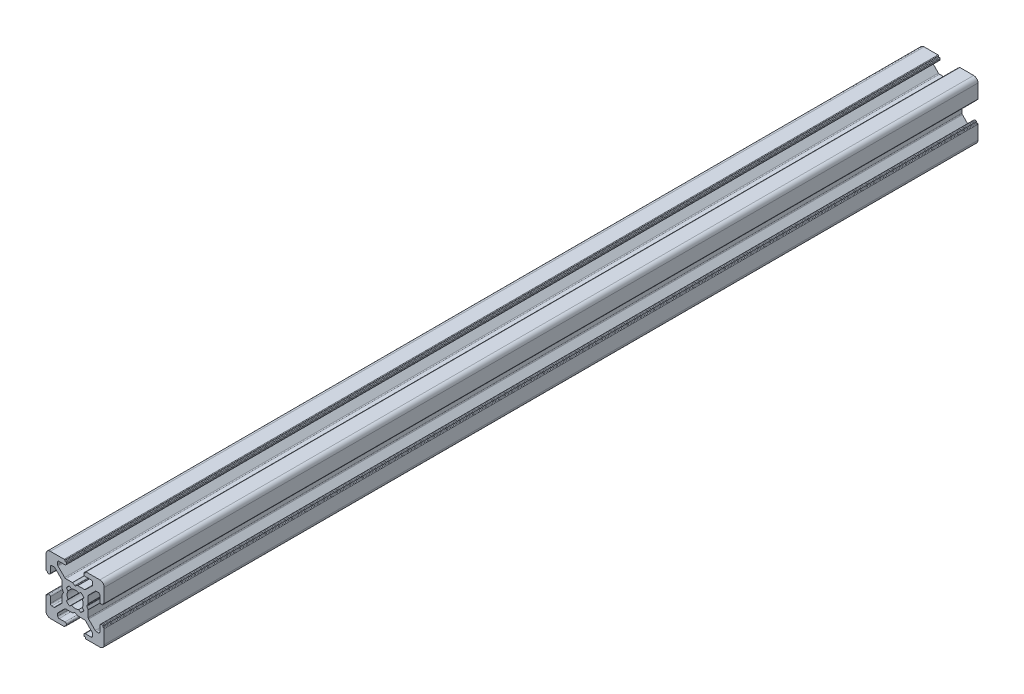
from build123d import *

# Parameters (mm, degrees)
BOSS_EXTRUDE1_DEPTH = 300


with BuildPart() as part:
    # Sketch3 → Boss-Extrude1 (new body)
    with BuildSketch(Plane.XY):
        with BuildLine():
            Line((-3.750000228, 10), (-8.5, 10))
            ThreePointArc((-8.5, 10), (-9.560660172, 9.560660172), (-10, 8.5))
            Line((-10, 8.5), (-10, 3.749999605))
            ThreePointArc((-10, 3.749999605), (-9.941421356, 3.608578248), (-9.8, 3.549999605))
            Line((-9.8, 3.549999605), (-9.699999732, 3.549999605))
            ThreePointArc((-9.699999732, 3.549999605), (-9.558578376, 3.491420961), (-9.499999732, 3.349999605))
            Line((-9.499999732, 3.349999605), (-9.499999732, 3.2))
            ThreePointArc((-9.499999732, 3.2), (-9.441421088, 3.058578644), (-9.299999732, 3))
            Line((-9.299999732, 3), (-8.999999732, 3))
            ThreePointArc((-8.999999732, 3), (-8.646446341, 3.146446609), (-8.499999732, 3.5))
            Line((-8.499999732, 3.5), (-8.499999732, 5.499999605))
            ThreePointArc((-8.499999732, 5.499999605), (-8.353553123, 5.853552995), (-7.999999732, 5.999999605))
            Line((-7.999999732, 5.999999605), (-7.267766685, 5.999999605))
            ThreePointArc((-7.267766685, 5.999999605), (-7.076424969, 5.961939371), (-6.914213294, 5.853552995))
            Line((-6.914213294, 5.853552995), (-4.646446398, 3.585786099))
            ThreePointArc((-4.646446398, 3.585786099), (-4.538060023, 3.423574425), (-4.499999789, 3.232232708))
            Line((-4.499999789, 3.232232708), (-4.499999789, 0.953589302))
            ThreePointArc((-4.499999789, 0.953589302), (-4.493184953, 0.90182549), (-4.473204867, 0.853589297))
            Line((-4.473204867, 0.853589297), (-4.038119841, 0.099999969))
            ThreePointArc((-4.038119841, 0.099999969), (-4.011324929, 0), (-4.038119841, -0.099999969))
            Line((-4.038119841, -0.099999969), (-4.473204867, -0.853589297))
            ThreePointArc((-4.473204867, -0.853589297), (-4.493184953, -0.90182549), (-4.499999789, -0.953589302))
            Line((-4.499999789, -0.953589302), (-4.499999789, -3.232232708))
            ThreePointArc((-4.499999789, -3.232232708), (-4.538060023, -3.423574425), (-4.646446398, -3.585786099))
            Line((-4.646446398, -3.585786099), (-6.914213294, -5.853552995))
            ThreePointArc((-6.914213294, -5.853552995), (-7.076424969, -5.961939371), (-7.267766685, -5.999999605))
            Line((-7.267766685, -5.999999605), (-7.999999732, -5.999999605))
            ThreePointArc((-7.999999732, -5.999999605), (-8.353553123, -5.853552995), (-8.499999732, -5.499999605))
            Line((-8.499999732, -5.499999605), (-8.499999732, -3.5))
            ThreePointArc((-8.499999732, -3.5), (-8.646446341, -3.146446609), (-8.999999732, -3))
            Line((-8.999999732, -3), (-9.299999732, -3))
            ThreePointArc((-9.299999732, -3), (-9.441421088, -3.058578644), (-9.499999732, -3.2))
            Line((-9.499999732, -3.2), (-9.499999732, -3.349999605))
            ThreePointArc((-9.499999732, -3.349999605), (-9.558578376, -3.491420961), (-9.699999732, -3.549999605))
            Line((-9.699999732, -3.549999605), (-9.8, -3.549999605))
            ThreePointArc((-9.8, -3.549999605), (-9.941421356, -3.608578248), (-10, -3.749999605))
            Line((-10, -3.749999605), (-10, -8.5))
            ThreePointArc((-10, -8.5), (-9.560660172, -9.560660172), (-8.5, -10))
            Line((-8.5, -10), (-3.750000228, -10))
            ThreePointArc((-3.750000228, -10), (-3.608578871, -9.941421356), (-3.550000228, -9.8))
            Line((-3.550000228, -9.8), (-3.550000228, -9.7))
            ThreePointArc((-3.550000228, -9.7), (-3.491421584, -9.558578644), (-3.350000228, -9.5))
            Line((-3.350000228, -9.5), (-3.2, -9.5))
            ThreePointArc((-3.2, -9.5), (-3.058578644, -9.441421356), (-3, -9.3))
            Line((-3, -9.3), (-3, -8.999999673))
            ThreePointArc((-3, -8.999999673), (-3.146446609, -8.646446283), (-3.5, -8.499999673))
            Line((-3.5, -8.499999673), (-5.500000686, -8.499999673))
            ThreePointArc((-5.500000686, -8.499999673), (-5.853554077, -8.353553064), (-6.000000686, -7.999999673))
            Line((-6.000000686, -7.999999673), (-6.000000686, -7.267766626))
            ThreePointArc((-6.000000686, -7.267766626), (-5.961940448, -7.076424899), (-5.853554059, -6.914213219))
            Line((-5.853554059, -6.914213219), (-3.585787212, -4.646446592))
            ThreePointArc((-3.585787212, -4.646446592), (-3.423575544, -4.538060229), (-3.232233839, -4.5))
            Line((-3.232233839, -4.5), (-0.953590312, -4.5))
            ThreePointArc((-0.953590312, -4.5), (-0.901826505, -4.493185166), (-0.853590316, -4.473205083))
            Line((-0.853590316, -4.473205083), (-0.100000045, -4.038119562))
            ThreePointArc((-0.100000045, -4.038119562), (0, -4.011324632), (0.100000045, -4.038119562))
            Line((0.100000045, -4.038119562), (0.853590316, -4.473205083))
            ThreePointArc((0.853590316, -4.473205083), (0.901826505, -4.493185166), (0.953590312, -4.5))
            Line((0.953590312, -4.5), (3.232233839, -4.5))
            ThreePointArc((3.232233839, -4.5), (3.423575544, -4.538060229), (3.585787212, -4.646446592))
            Line((3.585787212, -4.646446592), (5.853554059, -6.914213219))
            ThreePointArc((5.853554059, -6.914213219), (5.961940448, -7.076424899), (6.000000686, -7.267766626))
            Line((6.000000686, -7.267766626), (6.000000686, -7.999999673))
            ThreePointArc((6.000000686, -7.999999673), (5.853554077, -8.353553064), (5.500000686, -8.499999673))
            Line((5.500000686, -8.499999673), (3.5, -8.499999673))
            ThreePointArc((3.5, -8.499999673), (3.146446609, -8.646446283), (3, -8.999999673))
            Line((3, -8.999999673), (3, -9.3))
            ThreePointArc((3, -9.3), (3.058578644, -9.441421356), (3.2, -9.5))
            Line((3.2, -9.5), (3.350000228, -9.5))
            ThreePointArc((3.350000228, -9.5), (3.491421584, -9.558578644), (3.550000228, -9.7))
            Line((3.550000228, -9.7), (3.550000228, -9.8))
            ThreePointArc((3.550000228, -9.8), (3.608578871, -9.941421356), (3.750000228, -10))
            Line((3.750000228, -10), (8.5, -10))
            ThreePointArc((8.5, -10), (9.560660172, -9.560660172), (10, -8.5))
            Line((10, -8.5), (10, -3.749999605))
            ThreePointArc((10, -3.749999605), (9.941421356, -3.608578248), (9.8, -3.549999605))
            Line((9.8, -3.549999605), (9.699999732, -3.549999605))
            ThreePointArc((9.699999732, -3.549999605), (9.558578376, -3.491420961), (9.499999732, -3.349999605))
            Line((9.499999732, -3.349999605), (9.499999732, -3.2))
            ThreePointArc((9.499999732, -3.2), (9.441421088, -3.058578644), (9.299999732, -3))
            Line((9.299999732, -3), (8.999999732, -3))
            ThreePointArc((8.999999732, -3), (8.646446341, -3.146446609), (8.499999732, -3.5))
            Line((8.499999732, -3.5), (8.499999732, -5.499999605))
            ThreePointArc((8.499999732, -5.499999605), (8.353553123, -5.853552995), (7.999999732, -5.999999605))
            Line((7.999999732, -5.999999605), (7.267766685, -5.999999605))
            ThreePointArc((7.267766685, -5.999999605), (7.076424969, -5.961939371), (6.914213294, -5.853552995))
            Line((6.914213294, -5.853552995), (4.646446398, -3.585786099))
            ThreePointArc((4.646446398, -3.585786099), (4.538060023, -3.423574425), (4.499999789, -3.232232708))
            Line((4.499999789, -3.232232708), (4.499999789, -0.953589302))
            ThreePointArc((4.499999789, -0.953589302), (4.493184953, -0.90182549), (4.473204867, -0.853589297))
            Line((4.473204867, -0.853589297), (4.038119841, -0.099999969))
            ThreePointArc((4.038119841, -0.099999969), (4.011324929, 0), (4.038119841, 0.099999969))
            Line((4.038119841, 0.099999969), (4.473204867, 0.853589297))
            ThreePointArc((4.473204867, 0.853589297), (4.493184953, 0.90182549), (4.499999789, 0.953589302))
            Line((4.499999789, 0.953589302), (4.499999789, 3.232232708))
            ThreePointArc((4.499999789, 3.232232708), (4.538060023, 3.423574425), (4.646446398, 3.585786099))
            Line((4.646446398, 3.585786099), (6.914213294, 5.853552995))
            ThreePointArc((6.914213294, 5.853552995), (7.076424969, 5.961939371), (7.267766685, 5.999999605))
            Line((7.267766685, 5.999999605), (7.999999732, 5.999999605))
            ThreePointArc((7.999999732, 5.999999605), (8.353553123, 5.853552995), (8.499999732, 5.499999605))
            Line((8.499999732, 5.499999605), (8.499999732, 3.5))
            ThreePointArc((8.499999732, 3.5), (8.646446341, 3.146446609), (8.999999732, 3))
            Line((8.999999732, 3), (9.299999732, 3))
            ThreePointArc((9.299999732, 3), (9.441421088, 3.058578644), (9.499999732, 3.2))
            Line((9.499999732, 3.2), (9.499999732, 3.349999605))
            ThreePointArc((9.499999732, 3.349999605), (9.558578376, 3.491420961), (9.699999732, 3.549999605))
            Line((9.699999732, 3.549999605), (9.8, 3.549999605))
            ThreePointArc((9.8, 3.549999605), (9.941421356, 3.608578248), (10, 3.749999605))
            Line((10, 3.749999605), (10, 8.5))
            ThreePointArc((10, 8.5), (9.560660172, 9.560660172), (8.5, 10))
            Line((8.5, 10), (3.750000228, 10))
            ThreePointArc((3.750000228, 10), (3.608578871, 9.941421356), (3.550000228, 9.8))
            Line((3.550000228, 9.8), (3.550000228, 9.7))
            ThreePointArc((3.550000228, 9.7), (3.491421584, 9.558578644), (3.350000228, 9.5))
            Line((3.350000228, 9.5), (3.2, 9.5))
            ThreePointArc((3.2, 9.5), (3.058578644, 9.441421356), (3, 9.3))
            Line((3, 9.3), (3, 8.999999673))
            ThreePointArc((3, 8.999999673), (3.146446609, 8.646446283), (3.5, 8.499999673))
            Line((3.5, 8.499999673), (5.500000686, 8.499999673))
            ThreePointArc((5.500000686, 8.499999673), (5.853554077, 8.353553064), (6.000000686, 7.999999673))
            Line((6.000000686, 7.999999673), (6.000000686, 7.267766626))
            ThreePointArc((6.000000686, 7.267766626), (5.961940448, 7.076424899), (5.853554059, 6.914213219))
            Line((5.853554059, 6.914213219), (3.585787212, 4.646446592))
            ThreePointArc((3.585787212, 4.646446592), (3.423575544, 4.538060229), (3.232233839, 4.5))
            Line((3.232233839, 4.5), (0.953590312, 4.5))
            ThreePointArc((0.953590312, 4.5), (0.901826505, 4.493185166), (0.853590316, 4.473205083))
            Line((0.853590316, 4.473205083), (0.100000045, 4.038119562))
            ThreePointArc((0.100000045, 4.038119562), (0, 4.011324632), (-0.100000045, 4.038119562))
            Line((-0.100000045, 4.038119562), (-0.853590316, 4.473205083))
            ThreePointArc((-0.853590316, 4.473205083), (-0.901826505, 4.493185166), (-0.953590312, 4.5))
            Line((-0.953590312, 4.5), (-3.232233839, 4.5))
            ThreePointArc((-3.232233839, 4.5), (-3.423575544, 4.538060229), (-3.585787212, 4.646446592))
            Line((-3.585787212, 4.646446592), (-5.853554059, 6.914213219))
            ThreePointArc((-5.853554059, 6.914213219), (-5.961940448, 7.076424899), (-6.000000686, 7.267766626))
            Line((-6.000000686, 7.267766626), (-6.000000686, 7.999999673))
            ThreePointArc((-6.000000686, 7.999999673), (-5.853554077, 8.353553064), (-5.500000686, 8.499999673))
            Line((-5.500000686, 8.499999673), (-3.5, 8.499999673))
            ThreePointArc((-3.5, 8.499999673), (-3.146446609, 8.646446283), (-3, 8.999999673))
            Line((-3, 8.999999673), (-3, 9.3))
            ThreePointArc((-3, 9.3), (-3.058578644, 9.441421356), (-3.2, 9.5))
            Line((-3.2, 9.5), (-3.350000228, 9.5))
            ThreePointArc((-3.350000228, 9.5), (-3.491421584, 9.558578644), (-3.550000228, 9.7))
            Line((-3.550000228, 9.7), (-3.550000228, 9.8))
            ThreePointArc((-3.550000228, 9.8), (-3.608578871, 9.941421356), (-3.750000228, 10))
        make_face()
        with BuildLine():
            Line((-2.992174953, 1.909930962), (-2.445295423, 1.258185317))
            ThreePointArc((-2.445295423, 1.258185317), (-2.75, 0), (-2.445295423, -1.258185317))
            Line((-2.445295423, -1.258185317), (-2.992174953, -1.909930962))
            ThreePointArc((-2.992174953, -1.909930962), (-2.511737261, -2.508410485), (-1.91389502, -2.989640962))
            Line((-1.91389502, -2.989640962), (-1.258185436, -2.445295362))
            ThreePointArc((-1.258185436, -2.445295362), (0, -2.75), (1.258185436, -2.445295362))
            Line((1.258185436, -2.445295362), (1.91389502, -2.989640962))
            ThreePointArc((1.91389502, -2.989640962), (2.511737261, -2.508410485), (2.992174953, -1.909930962))
            Line((2.992174953, -1.909930962), (2.445295423, -1.258185317))
            ThreePointArc((2.445295423, -1.258185317), (2.75, 0), (2.445295423, 1.258185317))
            Line((2.445295423, 1.258185317), (2.992174953, 1.909930962))
            ThreePointArc((2.992174953, 1.909930962), (2.511737261, 2.508410485), (1.91389502, 2.989640962))
            Line((1.91389502, 2.989640962), (1.258185436, 2.445295362))
            ThreePointArc((1.258185436, 2.445295362), (0, 2.75), (-1.258185436, 2.445295362))
            Line((-1.258185436, 2.445295362), (-1.91389502, 2.989640962))
            ThreePointArc((-1.91389502, 2.989640962), (-2.511737261, 2.508410485), (-2.992174953, 1.909930962))
        make_face(mode=Mode.SUBTRACT)
    extrude(amount=BOSS_EXTRUDE1_DEPTH)


solid = part.part
